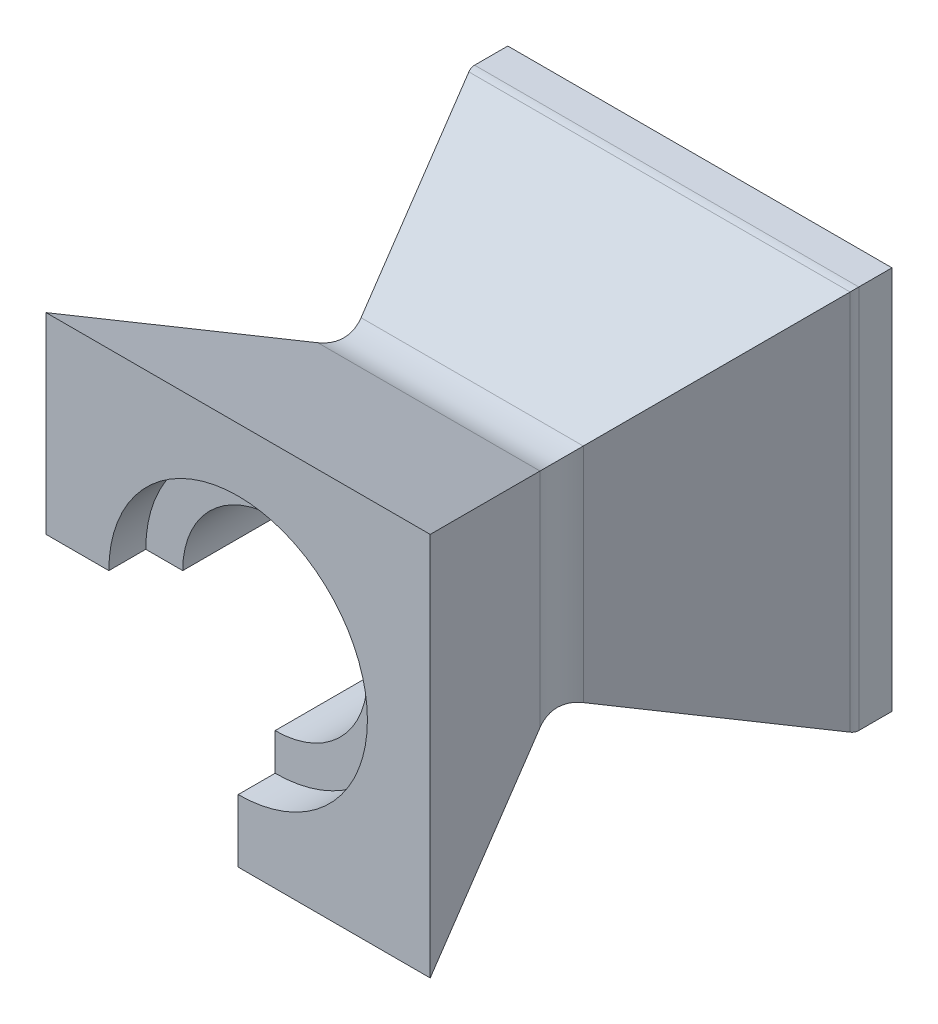
from build123d import *

# Parameters (mm, degrees)
SKETCH4_W               = 104
SKETCH4_H               = 104
BOSS_EXTRUDE2_DEPTH     = 57.5
BOSS_EXTRUDE2_TAPER     = 23
SKETCH6_R               = 25
CUT_EXTRUDE1_DEPTH      = 179.5
CUT_EXTRUDE_THIN1_START = 10
CUT_EXTRUDE_THIN1_DEPTH = 10
CUT_EXTRUDE3_DEPTH      = 124
SKETCH10_R              = 35
CUT_EXTRUDE4_DEPTH      = 10
FILLET9_R               = 15
FILLET10_R              = 15
BOSS_EXTRUDE5_DEPTH     = 10
FILLET16_R              = 5
FILLET17_R              = 5
CUT_EXTRUDE6_DEPTH      = 10
CUT_EXTRUDE7_DEPTH      = 10


with BuildPart() as part:
    # Sketch4 → Boss-Extrude2 (new body)
    with BuildSketch(Plane.XY):
        with Locations((52, 52)):
            Rectangle(SKETCH4_W, SKETCH4_H)
    boss_extrude2 = extrude(amount=BOSS_EXTRUDE2_DEPTH, taper=BOSS_EXTRUDE2_TAPER)

    # Mirror2: Boss-Extrude2 across plane
    add(boss_extrude2.mirror(Plane(origin=(0, 0, 57.5), x_dir=(1, 0, 0), z_dir=(0, 0, -1))))

    # Sketch6 → Cut-Extrude1 (cut)
    with BuildSketch(Plane.XY.offset(115)):
        with Locations((52, 52)):
            Circle(SKETCH6_R)
    extrude(amount=-CUT_EXTRUDE1_DEPTH, mode=Mode.SUBTRACT)

    # Sketch8 → Cut-Extrude-Thin1 (cut)
    with BuildSketch(Plane.XY.offset(CUT_EXTRUDE_THIN1_START)):
        with BuildLine():
            ThreePointArc((52, 17), (76.748737342, 76.748737342), (17, 52))
            Line((17, 52), (7, 52))
            ThreePointArc((7, 52), (83.819805153, 83.819805153), (52, 7))
            Line((52, 7), (52, 17))
        make_face()
        with BuildLine():
            ThreePointArc((52, 27), (69.67766953, 69.67766953), (27, 52))
            Line((27, 52), (17, 52))
            ThreePointArc((17, 52), (76.748737342, 76.748737342), (52, 17))
            Line((52, 17), (52, 27))
        make_face()
    extrude(amount=-CUT_EXTRUDE_THIN1_DEPTH, mode=Mode.SUBTRACT)

    # Sketch9 → Cut-Extrude3 (cut)
    with BuildSketch(Plane(origin=(0, 0, 0), x_dir=(-1, 0, 0), z_dir=(0, 0, -1))):
        Polygon((-27, 52), (0, 52), (0, 0), (-52, 0), (-52, 27), (-52, 52), align=None)
    extrude(amount=-CUT_EXTRUDE3_DEPTH, mode=Mode.SUBTRACT)

    # Sketch10 → Cut-Extrude4 (cut)
    with BuildSketch(Plane.XY.offset(115)):
        with Locations((52, 52)):
            Circle(SKETCH10_R)
    extrude(amount=-CUT_EXTRUDE4_DEPTH, mode=Mode.SUBTRACT)

    # Fillet9
    fillet9_edges = [part.edges().sort_by_distance(p)[0] for p in [
        (65.796349034, 24.407301932, 57.5),
    ]]
    fillet(fillet9_edges, radius=FILLET9_R)

    # Fillet10
    fillet10_edges = [part.edges().sort_by_distance(p)[0] for p in [
        (24.407301932, 65.796349034, 57.5),
        (52, 79.592698068, 57.5),
        (79.592698068, 51.352297169, 57.5),
    ]]
    fillet(fillet10_edges, radius=FILLET10_R)

    # Sketch12 → Boss-Extrude5 (add)
    with BuildSketch(Plane(origin=(0, 0, 0), x_dir=(-1, 0, 0), z_dir=(0, 0, -1))):
        Polygon((-104, 104), (0, 104), (0, 52), (-3, 52), (-3, 101), (-101, 101), (-101, 3), (-52, 3), (-52, 0), (-104, 0), align=None)
    extrude(amount=BOSS_EXTRUDE5_DEPTH)

    # Fillet16
    fillet16_edges = [part.edges().sort_by_distance(p)[0] for p in [
        (78, 0, 0),
    ]]
    fillet(fillet16_edges, radius=FILLET16_R)

    # Fillet17
    fillet17_edges = [part.edges().sort_by_distance(p)[0] for p in [
        (0, 78, 0),
        (52, 104, 0),
        (104, 52.052287852, 0),
    ]]
    fillet(fillet17_edges, radius=FILLET17_R)

    # Sketch14 → Cut-Extrude6 (cut)
    with BuildSketch(Plane(origin=(0, 0, 0), x_dir=(-1, 0, 0), z_dir=(0, 0, -1))):
        with BuildLine():
            Line((-94.485281374, 98.727922061), (-83.878679656, 88.121320344))
            ThreePointArc((-83.878679656, 88.121320344), (-83.878679656, 83.878679656), (-88.121320344, 83.878679656))
            Line((-88.121320344, 83.878679656), (-98.727922061, 94.485281374))
            ThreePointArc((-98.727922061, 94.485281374), (-98.727922061, 98.727922061), (-94.485281374, 98.727922061))
        make_face()
    extrude(amount=-CUT_EXTRUDE6_DEPTH, mode=Mode.SUBTRACT)

    # Sketch15 → Cut-Extrude7 (cut)
    with BuildSketch(Plane(origin=(0, 0, 0), x_dir=(-1, 0, 0), z_dir=(0, 0, -1))):
        with BuildLine():
            Line((-20.170334378, 88.072306309), (-9.56373266, 98.678908027))
            ThreePointArc((-9.56373266, 98.678908027), (-5.321091973, 98.678908027), (-5.321091973, 94.43626734))
            Line((-5.321091973, 94.43626734), (-15.927693691, 83.829665622))
            ThreePointArc((-15.927693691, 83.829665622), (-20.170334378, 83.829665622), (-20.170334378, 88.072306309))
        make_face()
        with BuildLine():
            Line((-83.832077939, 15.925281374), (-94.438679656, 5.318679656))
            ThreePointArc((-94.438679656, 5.318679656), (-98.681320344, 5.318679656), (-98.681320344, 9.561320344))
            Line((-98.681320344, 9.561320344), (-88.074718626, 20.167922061))
            ThreePointArc((-88.074718626, 20.167922061), (-83.832077939, 20.167922061), (-83.832077939, 15.925281374))
        make_face()
    extrude(amount=-CUT_EXTRUDE7_DEPTH, mode=Mode.SUBTRACT)


solid = part.part
